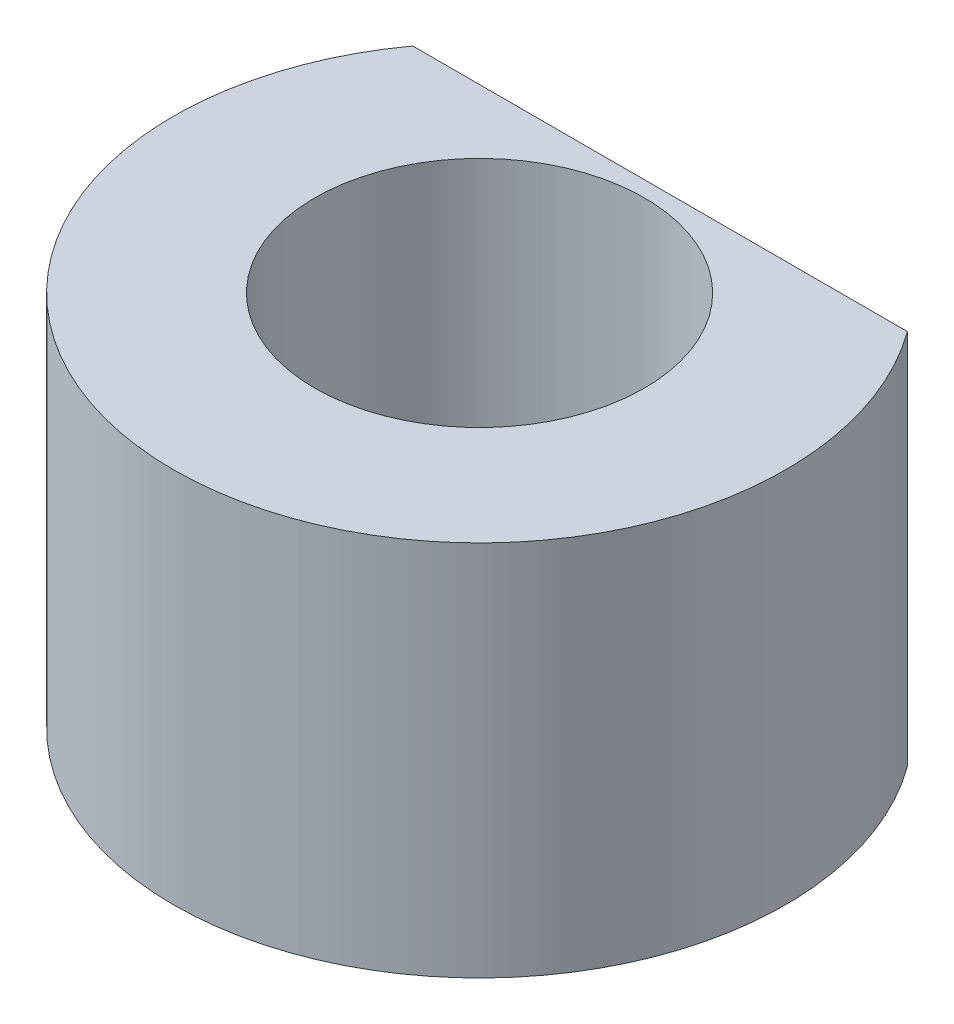
from build123d import *

# Parameters (mm, degrees)
BOSS_EXTRUDE1_DEPTH = 2.4
SKETCH2_R           = 1.05
CUT_EXTRUDE1_DEPTH  = 4.655817282


with BuildPart() as part:
    # Sketch1 → Boss-Extrude1 (new body)
    with BuildSketch(Plane(origin=(0, 0, 0), x_dir=(1, 0, 0), z_dir=(0, 1, 0))):
        with BuildLine():
            Line((1.575, 1.149728229), (-1.575, 1.149728229))
            ThreePointArc((-1.575, 1.149728229), (-0.604669331, -1.853881064), (1.95, 0))
            ThreePointArc((1.95, 0), (1.853881064, 0.604669331), (1.575, 1.149728229))
        make_face()
    extrude(amount=BOSS_EXTRUDE1_DEPTH)

    # Sketch2 → Cut-Extrude1 (cut, through all)
    with BuildSketch(Plane(origin=(0, 2.4, 0), x_dir=(1, 0, 0), z_dir=(0, 1, 0))):
        with Locations(Location((0, 0, 0), (0, 0, 270))):
            Circle(SKETCH2_R)
    extrude(amount=-CUT_EXTRUDE1_DEPTH, mode=Mode.SUBTRACT)


solid = part.part
